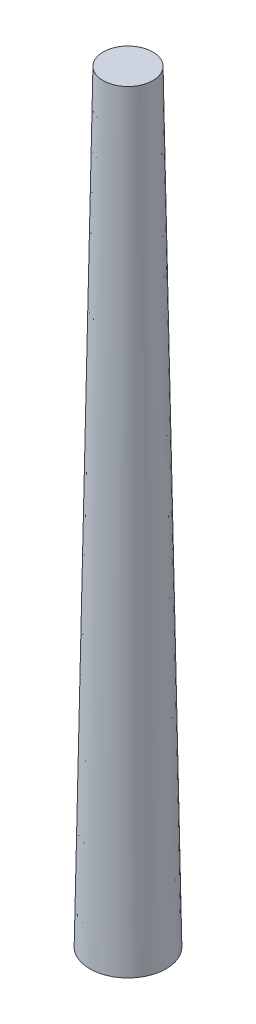
from build123d import *

# Parameters (mm, degrees)
SKETCH1_R           = 5
BOSS_EXTRUDE1_DEPTH = 100
BOSS_EXTRUDE1_TAPER = 1


with BuildPart() as part:
    # Sketch1 → Boss-Extrude1 (new body)
    with BuildSketch(Plane(origin=(0, 0, 0), x_dir=(1, 0, 0), z_dir=(0, 1, 0))):
        Circle(SKETCH1_R)
    extrude(amount=BOSS_EXTRUDE1_DEPTH, taper=BOSS_EXTRUDE1_TAPER)


solid = part.part
